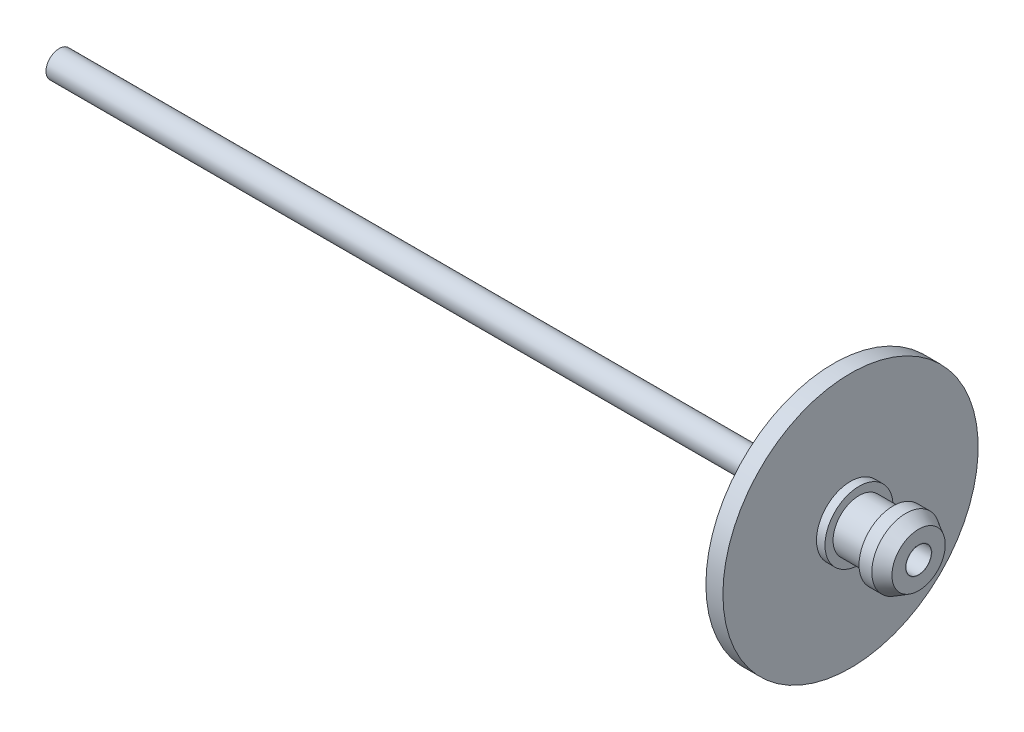
from build123d import *

# Parameters (mm, degrees)
SKETCH_3_R      = 3.1
SKETCH_3_R_2    = 3
EXTRUDE_1_DEPTH = 202


with BuildPart() as part:
    # Эскиз1 → Повернуть1 (revolve)
    with BuildSketch(Plane.XY, mode=Mode.PRIVATE) as revolve_1_sk:
        Polygon((0, 21.958452658), (0, 30), (4, 30), (4, 8), (5.995778665, 8), (5.995778665, 6.1), (13.995778665, 6.1), (13.995778665, 8), (17, 8), (20, 6.267949192), (20, 3.1), (0, 3.1), align=None)
    revolve(revolve_1_sk.sketch.rotate(Axis((0, 0, 0), (1, 0, 0)), 90), axis=Axis((0, 0, 0), (1, 0, 0)))


with BuildPart() as body_2:
    # Эскиз3 → Бобышка-Вытянуть1 (new body)
    with BuildSketch(Plane(origin=(20, 0, 0), x_dir=(0, 0, -1), z_dir=(1, 0, 0))):
        Circle(SKETCH_3_R)
        Circle(SKETCH_3_R_2, mode=Mode.SUBTRACT)
    extrude(amount=-EXTRUDE_1_DEPTH)


solid = Compound([part.part, body_2.part])
